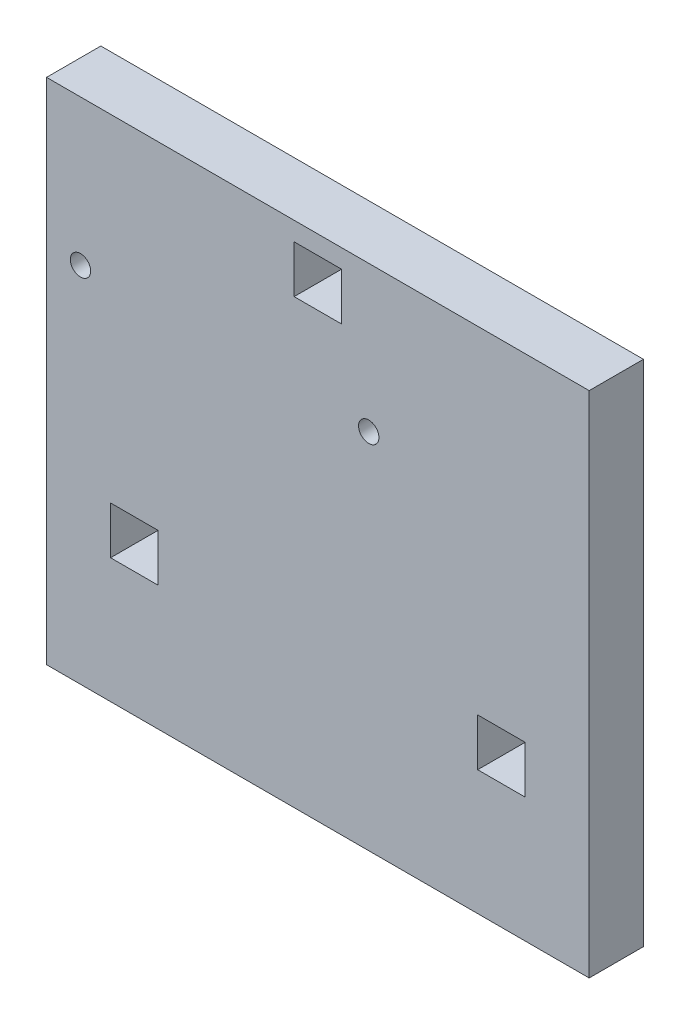
from build123d import *

# Parameters (mm, degrees)
SKETCH1_W           = 160
SKETCH1_H           = 150
BOSS_EXTRUDE1_DEPTH = 16
SKETCH2_W           = 14
SKETCH2_H           = 14
CUT_EXTRUDE1_DEPTH  = 14
SKETCH3_R           = 3
CUT_EXTRUDE2_DEPTH  = 220.899977262


with BuildPart() as part:
    # Sketch1 → Boss-Extrude1 (new body)
    with BuildSketch(Plane.XY):
        with Locations((-80, -75)):
            Rectangle(SKETCH1_W, SKETCH1_H)
    extrude(amount=BOSS_EXTRUDE1_DEPTH)

    # Sketch2 → Cut-Extrude1 (cut)
    with BuildSketch(Plane.XY.offset(16)):
        with Locations((-80, -12.5)):
            Rectangle(SKETCH2_W, SKETCH2_H)
        with Locations((-134.126587737, -106.25)):
            Rectangle(SKETCH2_W, SKETCH2_H)
        with Locations((-25.873412263, -106.25)):
            Rectangle(SKETCH2_W, SKETCH2_H)
    extrude(amount=-CUT_EXTRUDE1_DEPTH, mode=Mode.SUBTRACT)

    # Sketch3 → Cut-Extrude2 (cut, through all)
    with BuildSketch(Plane.XY.offset(16)):
        with Locations((-65, -43)):
            Circle(SKETCH3_R)
        with Locations((-150, -43)):
            Circle(SKETCH3_R)
    extrude(amount=-CUT_EXTRUDE2_DEPTH, mode=Mode.SUBTRACT)


solid = part.part
